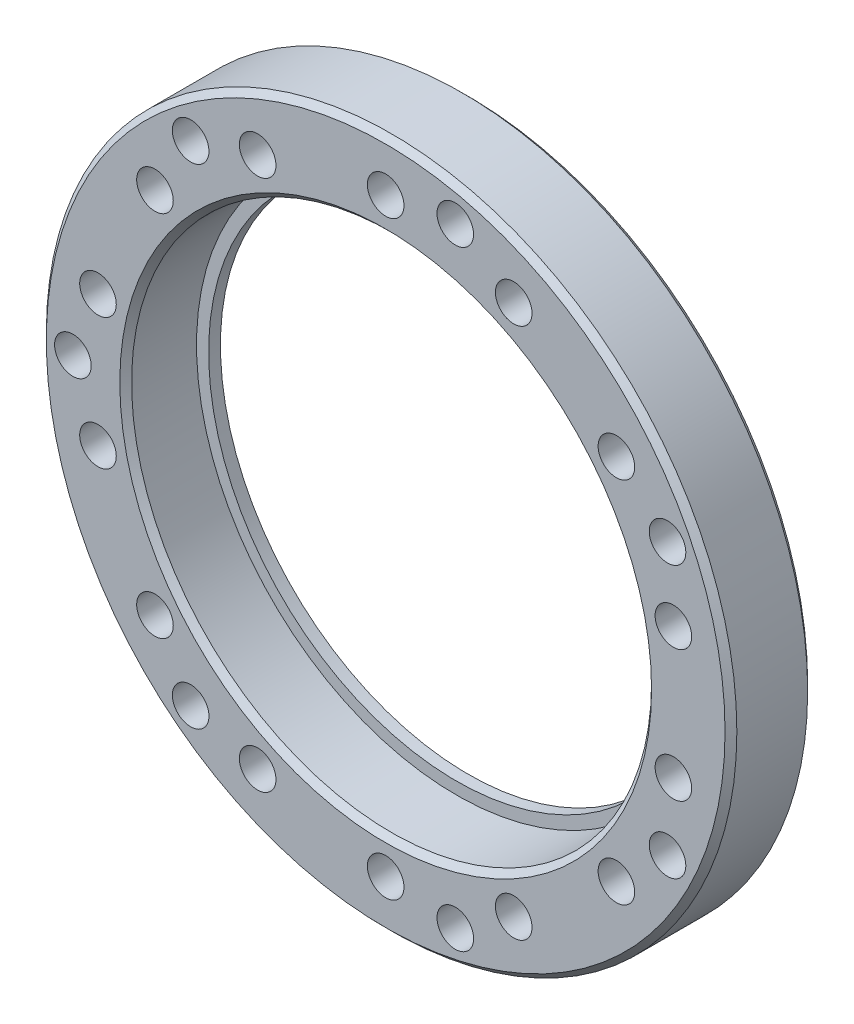
from build123d import *

# Parameters (mm, degrees)
SKETCH1_R           = 29.25
SKETCH1_R_2         = 22.025
BOSS_EXTRUDE1_DEPTH = 7
CUT_EXTRUDE1_START  = 7
SKETCH1_3_R         = 1.55
CUT_EXTRUDE1_DEPTH  = 4
SKETCH4_R           = 22.25
SKETCH4_R_2         = 21
BOSS_EXTRUDE2_DEPTH = 1
SKETCH3_R           = 1.55
CUT_EXTRUDE2_DEPTH  = 42.953843686
CHAMFER1_SIZE       = 0.5


with BuildPart() as part:
    # Sketch1 → Boss-Extrude1 (new body)
    with BuildSketch(Plane.XY):
        Circle(SKETCH1_R)
        Circle(SKETCH1_R_2, mode=Mode.SUBTRACT)
    extrude(amount=BOSS_EXTRUDE1_DEPTH)

    # Sketch1<3> → Cut-Extrude1 (cut)
    with BuildSketch(Plane.XY.offset(CUT_EXTRUDE1_START)):
        with Locations((0, 25)):
            Circle(SKETCH1_3_R)
        with Locations((10.847093478, 22.524221698)):
            Circle(SKETCH1_3_R)
        with Locations((19.545787062, 15.587245046)):
            Circle(SKETCH1_3_R)
        with Locations((24.373197805, 5.563023349)):
            Circle(SKETCH1_3_R)
        with Locations((24.373197805, -5.563023349)):
            Circle(SKETCH1_3_R)
        with Locations((19.545787062, -15.587245046)):
            Circle(SKETCH1_3_R)
        with Locations((10.847093478, -22.524221698)):
            Circle(SKETCH1_3_R)
        with Locations((0, -25)):
            Circle(SKETCH1_3_R)
        with Locations((-10.847093478, -22.524221698)):
            Circle(SKETCH1_3_R)
        with Locations((-19.545787062, -15.587245046)):
            Circle(SKETCH1_3_R)
        with Locations((-24.373197805, -5.563023349)):
            Circle(SKETCH1_3_R)
        with Locations((-24.373197805, 5.563023349)):
            Circle(SKETCH1_3_R)
        with Locations((-19.545787062, 15.587245046)):
            Circle(SKETCH1_3_R)
        with Locations((-10.847093478, 22.524221698)):
            Circle(SKETCH1_3_R)
    extrude(amount=-CUT_EXTRUDE1_DEPTH, mode=Mode.SUBTRACT)

    # Sketch4 → Boss-Extrude2 (add)
    with BuildSketch(Plane.XY):
        Circle(SKETCH4_R)
        Circle(SKETCH4_R_2, mode=Mode.SUBTRACT)
    extrude(amount=BOSS_EXTRUDE2_DEPTH)

    # Sketch3 → Cut-Extrude2 (cut, through all)
    with BuildSketch(Plane.XY):
        with Locations((5.89680475, 25.835589673)):
            Circle(SKETCH3_R)
        with Locations((23.875674999, 11.497919087)):
            Circle(SKETCH3_R)
        with Locations((23.875674999, -11.497919087)):
            Circle(SKETCH3_R)
        with Locations((5.89680475, -25.835589673)):
            Circle(SKETCH3_R)
        with Locations((-16.522479749, -20.718534285)):
            Circle(SKETCH3_R)
        with Locations((-26.5, 0)):
            Circle(SKETCH3_R)
        with Locations((-16.522479749, 20.718534285)):
            Circle(SKETCH3_R)
    extrude(amount=CUT_EXTRUDE2_DEPTH, mode=Mode.SUBTRACT)

    # Chamfer1
    chamfer1_edges = [part.edges().sort_by_distance(p)[0] for p in [
        (-22.025, 0, 7),
        (-29.25, 0, 0),
        (-29.25, 0, 7),
    ]]
    chamfer(chamfer1_edges, length=CHAMFER1_SIZE)


solid = part.part
